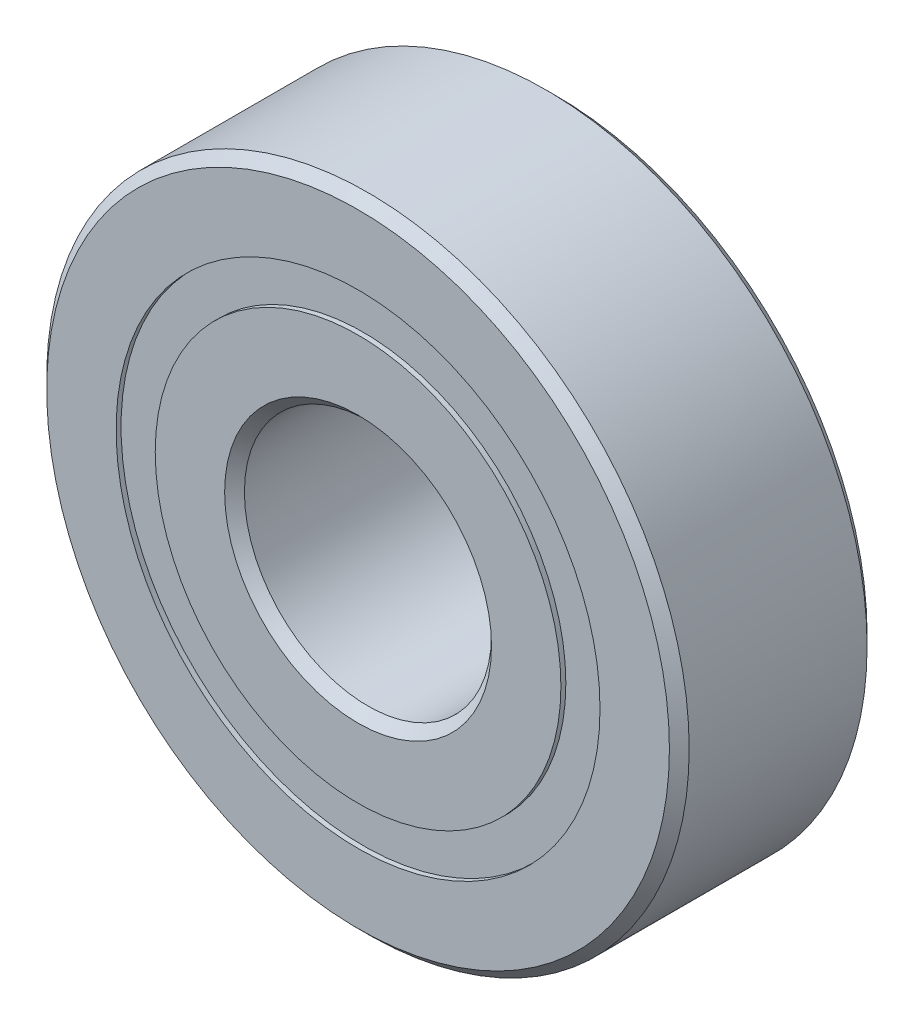
from build123d import *

# Parameters (mm, degrees)
CIRPATTERN1_COUNT = 12
SKETCH5_W         = 0.927052779
SKETCH5_H         = 0.791208792


with BuildPart() as part:
    # Sketch1 → Revolve1 (revolve)
    with BuildSketch(Plane(origin=(0, 0, 0), x_dir=(0, 0, -1), z_dir=(1, 0, 0)), mode=Mode.PRIVATE) as revolve1_sk:
        with BuildLine():
            Line((1.8, 6.5), (-1.8, 6.5))
            Line((-1.8, 6.5), (-2, 6.3))
            Line((-2, 6.3), (-2, 4.895604396))
            Line((-2, 4.895604396), (-0.888888889, 4.895604396))
            ThreePointArc((-0.888888889, 4.895604396), (0, 5.472947221), (0.888888889, 4.895604396))
            Line((0.888888889, 4.895604396), (2, 4.895604396))
            Line((2, 4.895604396), (2, 6.3))
            Line((2, 6.3), (1.8, 6.5))
        make_face()
    revolve(revolve1_sk.sketch.rotate(Axis((0, 0, 2), (0, 0, -1)), 90), axis=Axis((0, 0, 2), (0, 0, -1)))


with BuildPart() as body_2:
    # Sketch3 → Revolve3 (revolve)
    with BuildSketch(Plane(origin=(0, 0, 0), x_dir=(0, 0, -1), z_dir=(1, 0, 0)), mode=Mode.PRIVATE) as revolve3_sk:
        with BuildLine():
            Line((-2, 4.104395604), (-0.888888889, 4.104395604))
            ThreePointArc((-0.888888889, 4.104395604), (0, 3.527052779), (0.888888889, 4.104395604))
            Line((0.888888889, 4.104395604), (2, 4.104395604))
            Line((2, 4.104395604), (2, 2.7))
            Line((2, 2.7), (1.8, 2.5))
            Line((1.8, 2.5), (-1.8, 2.5))
            Line((-1.8, 2.5), (-2, 2.7))
            Line((-2, 2.7), (-2, 4.104395604))
        make_face()
    revolve(revolve3_sk.sketch.rotate(Axis((0, 0, 2), (0, 0, -1)), 90), axis=Axis((0, 0, 2), (0, 0, -1)))


with BuildPart() as body_3:
    # Sketch4 → Revolve4 (revolve)
    with BuildSketch(Plane(origin=(0, 0, 0), x_dir=(0, 0, -1), z_dir=(1, 0, 0))):
        with BuildLine():
            Line((-0.972947221, 4.5), (0.972947221, 4.5))
            ThreePointArc((0.972947221, 4.5), (0, 5.472947221), (-0.972947221, 4.5))
        make_face()
    revolve(axis=Axis((0, 4.5, 0.972947221), (0, 0, -1)))


with BuildPart() as cirpattern1_1:
    # CirPattern1: pattern copy
    add(body_3.part.rotate(Axis((0, 0, 0), (0, 0, 1)), 1 * 360 / CIRPATTERN1_COUNT))


with BuildPart() as cirpattern1_2:
    # CirPattern1: pattern copy
    add(body_3.part.rotate(Axis((0, 0, 0), (0, 0, 1)), 2 * 360 / CIRPATTERN1_COUNT))


with BuildPart() as cirpattern1_3:
    # CirPattern1: pattern copy
    add(body_3.part.rotate(Axis((0, 0, 0), (0, 0, 1)), 3 * 360 / CIRPATTERN1_COUNT))


with BuildPart() as cirpattern1_4:
    # CirPattern1: pattern copy
    add(body_3.part.rotate(Axis((0, 0, 0), (0, 0, 1)), 4 * 360 / CIRPATTERN1_COUNT))


with BuildPart() as cirpattern1_5:
    # CirPattern1: pattern copy
    add(body_3.part.rotate(Axis((0, 0, 0), (0, 0, 1)), 5 * 360 / CIRPATTERN1_COUNT))


with BuildPart() as cirpattern1_6:
    # CirPattern1: pattern copy
    add(body_3.part.rotate(Axis((0, 0, 0), (0, 0, 1)), 6 * 360 / CIRPATTERN1_COUNT))


with BuildPart() as cirpattern1_7:
    # CirPattern1: pattern copy
    add(body_3.part.rotate(Axis((0, 0, 0), (0, 0, 1)), 7 * 360 / CIRPATTERN1_COUNT))


with BuildPart() as cirpattern1_8:
    # CirPattern1: pattern copy
    add(body_3.part.rotate(Axis((0, 0, 0), (0, 0, 1)), 8 * 360 / CIRPATTERN1_COUNT))


with BuildPart() as cirpattern1_9:
    # CirPattern1: pattern copy
    add(body_3.part.rotate(Axis((0, 0, 0), (0, 0, 1)), 9 * 360 / CIRPATTERN1_COUNT))


with BuildPart() as cirpattern1_10:
    # CirPattern1: pattern copy
    add(body_3.part.rotate(Axis((0, 0, 0), (0, 0, 1)), 10 * 360 / CIRPATTERN1_COUNT))


with BuildPart() as cirpattern1_11:
    # CirPattern1: pattern copy
    add(body_3.part.rotate(Axis((0, 0, 0), (0, 0, 1)), 11 * 360 / CIRPATTERN1_COUNT))


with BuildPart() as body_15:
    # Sketch5 → Revolve5 (revolve)
    with BuildSketch(Plane(origin=(0, 0, 0), x_dir=(0, 0, -1), z_dir=(1, 0, 0)), mode=Mode.PRIVATE) as revolve5_sk:
        with Locations((-1.436473611, 4.5)):
            Rectangle(SKETCH5_W, SKETCH5_H)
        with Locations((1.436473611, 4.5)):
            Rectangle(SKETCH5_W, SKETCH5_H)
    revolve(revolve5_sk.sketch.rotate(Axis((0, 0, 2), (0, 0, -1)), 90), axis=Axis((0, 0, 2), (0, 0, -1)))


solid = Compound([part.part, body_2.part, body_3.part, cirpattern1_1.part, cirpattern1_2.part, cirpattern1_3.part, cirpattern1_4.part, cirpattern1_5.part, cirpattern1_6.part, cirpattern1_7.part, cirpattern1_8.part, cirpattern1_9.part, cirpattern1_10.part, cirpattern1_11.part, body_15.part])
